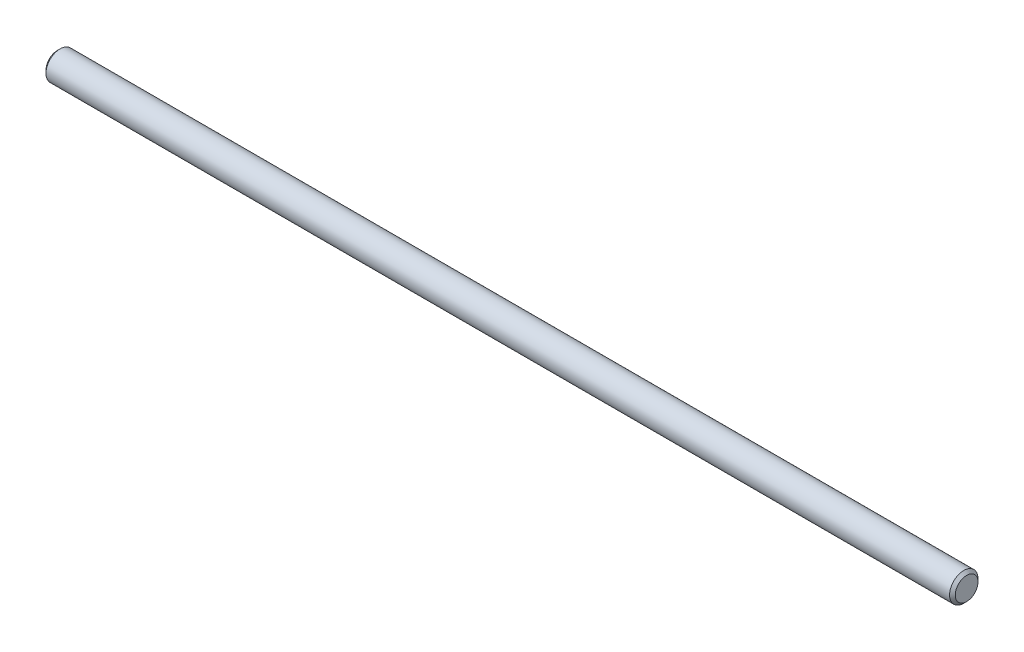
from build123d import *

# Parameters (mm, degrees)
EXTRUDE1_DEPTH      = 203.2
EXTRUDE1_DEPTH_BACK = 203.2
SKETCH2_R           = 6.35
CHAMFER1_SIZE       = 1.27


with BuildPart() as part:
    # Sketch2 → Extrude1 (new, two sides: drawn at the far end of the back side and taken through both)
    with BuildSketch(Plane(origin=(0, 0, 0), x_dir=(0, 0, -1), z_dir=(1, 0, 0)).offset(-EXTRUDE1_DEPTH_BACK)):
        Circle(SKETCH2_R)
    extrude(amount=EXTRUDE1_DEPTH + EXTRUDE1_DEPTH_BACK)

    # Chamfer1
    chamfer1_edges = [part.edges().sort_by_distance(p)[0] for p in [
        (-203.2, 0, 6.35),
        (203.2, 0, 6.35),
    ]]
    chamfer(chamfer1_edges, length=CHAMFER1_SIZE)


solid = part.part
